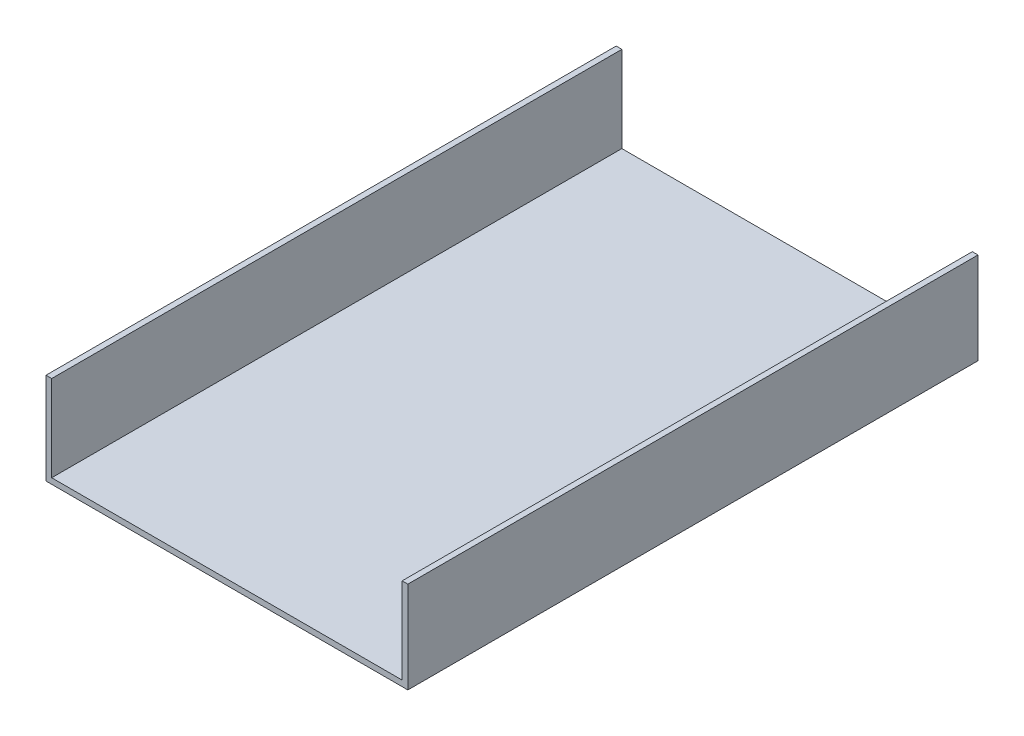
from build123d import *

# Parameters (mm, degrees)
CROQUIS1_W              = 101.54
CROQUIS1_H              = 25.72
CROQUIS1_W_2            = 98.34
CROQUIS1_H_2            = 22.52
SALIENTE_EXTRUIR1_DEPTH = 80
CROQUIS2_W              = 98.34
CROQUIS2_H              = 160
CORTAR_EXTRUIR1_DEPTH   = 11.1


with BuildPart() as part:
    # Croquis1 → Saliente-Extruir1 (new, symmetric)
    with BuildSketch(Plane.XY):
        Rectangle(CROQUIS1_W, CROQUIS1_H)
        Rectangle(CROQUIS1_W_2, CROQUIS1_H_2, mode=Mode.SUBTRACT)
    extrude(amount=SALIENTE_EXTRUIR1_DEPTH, both=True)

    # Croquis2 → Cortar-Extruir1 (cut)
    with BuildSketch(Plane(origin=(0, 12.86, 0), x_dir=(1, 0, 0), z_dir=(0, 1, 0))):
        Rectangle(CROQUIS2_W, CROQUIS2_H)
    extrude(amount=-CORTAR_EXTRUIR1_DEPTH, mode=Mode.SUBTRACT)


solid = part.part
